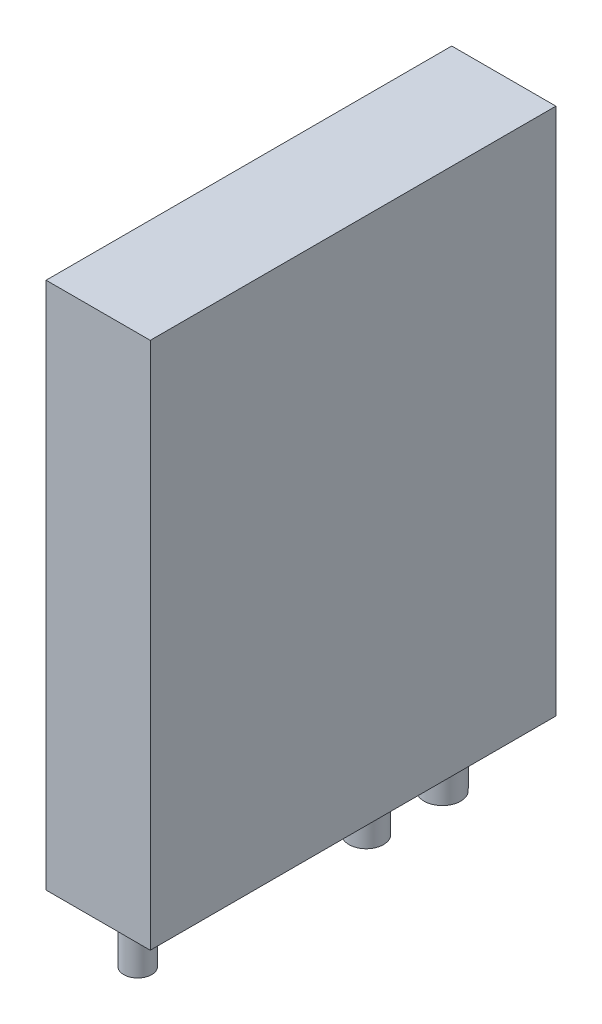
from build123d import *

# Parameters (mm, degrees)
SKETCH1_W           = 20.29
SKETCH1_H           = 26.42
BOSS_EXTRUDE1_DEPTH = 5.21
SKETCH2_R           = 0.915
SKETCH2_R_2         = 0.865
SKETCH2_R_3         = 0.7
BOSS_EXTRUDE2_DEPTH = 3


with BuildPart() as part:
    # Sketch1 → Boss-Extrude1 (new body)
    with BuildSketch(Plane(origin=(0, 0, 0), x_dir=(0, 0, -1), z_dir=(1, 0, 0))):
        Rectangle(SKETCH1_W, SKETCH1_H)
    extrude(amount=BOSS_EXTRUDE1_DEPTH)

    # Sketch2 → Boss-Extrude2 (add)
    with BuildSketch(Plane.XZ.offset(13.21)):
        with Locations(Location((2.605, -7.073929595, 0), (0, 0, 90))):
            Circle(SKETCH2_R)
        with Locations(Location((2.605, -3.263929595, 0), (0, 0, 90))):
            Circle(SKETCH2_R_2)
        with Locations(Location((2.605, 8.166070405, 0), (0, 0, 90))):
            Circle(SKETCH2_R_3)
    extrude(amount=BOSS_EXTRUDE2_DEPTH)


solid = part.part
